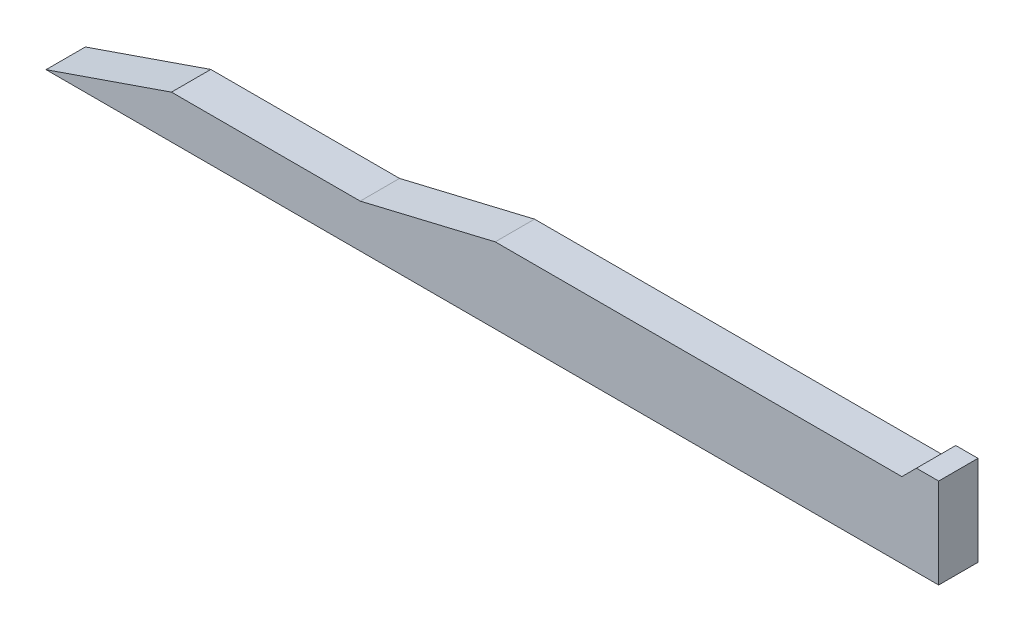
from build123d import *

# Parameters (mm, degrees)
BOSS_EXTRUDE1_DEPTH = 5


with BuildPart() as part:
    # Sketch1 → Boss-Extrude1 (new body)
    with BuildSketch(Plane.XY):
        Polygon((0, 0), (15.953944958, 5.503013505), (39.950321785, 5.503013505), (57.118461303, 9.59995589), (108.817972352, 9.59995589), (110.67135105, 11.453334588), (113.500192221, 11.453334588), (113.500192221, 0), align=None)
    extrude(amount=BOSS_EXTRUDE1_DEPTH)


solid = part.part
